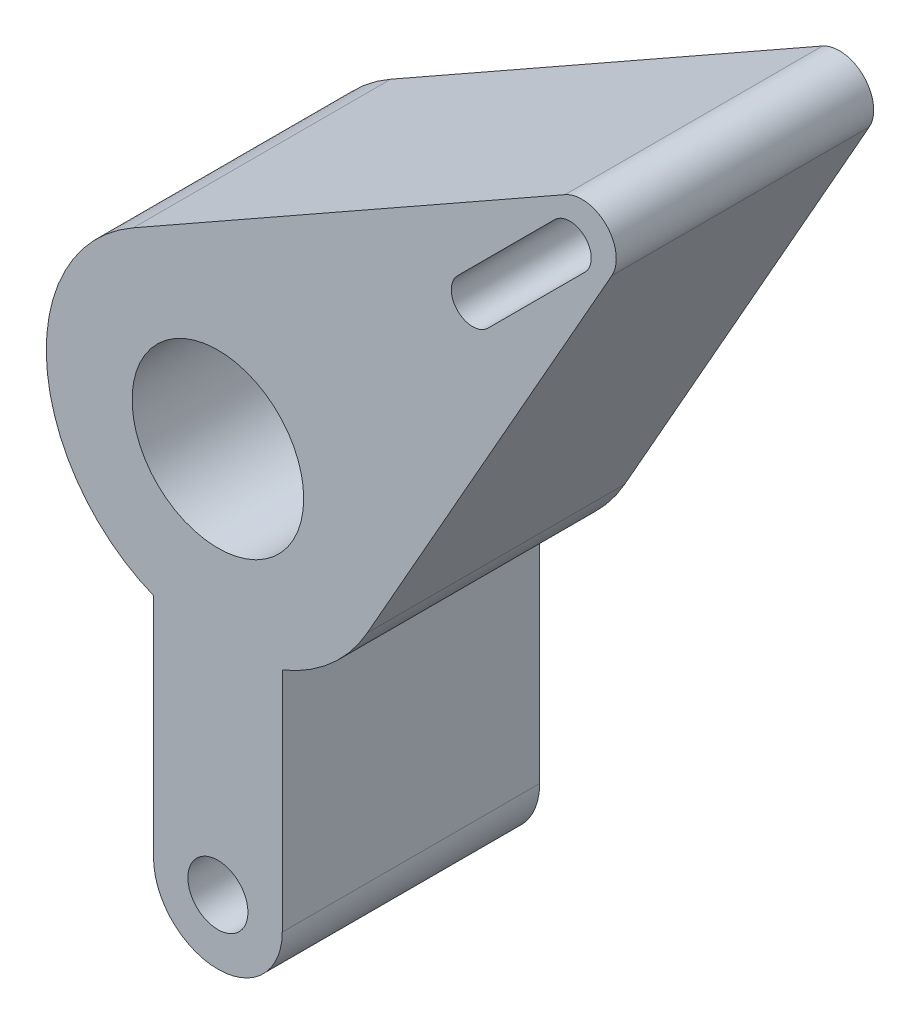
from build123d import *

# Parameters (mm, degrees)
SKETCH_1_R          = 3.5
SKETCH_1_R_2        = 4
EXTRUDE_1_DEPTH     = 30
SKETCH_3_R          = 10
CUT_EXTRUDE_1_DEPTH = 77.234252505


with BuildPart() as part:
    # Эскиз1 → Бобышка-Вытянуть1 (new body)
    # profile 1 of 7: a face of its own
    with BuildSketch(Plane.XY):
        with BuildLine():
            Line((40.454647664, 45.906660544), (-9.858796034, 17.401268367))
            ThreePointArc((-9.858796034, 17.401268367), (10.070354495, 17.279697924), (20, 0))
            ThreePointArc((20, 0), (19.339407531, -5.097775626), (17.401268367, -9.858796034))
            Line((17.401268367, -9.858796034), (45.906660544, 40.454647664))
            ThreePointArc((45.906660544, 40.454647664), (39.597979746, 39.597979746), (40.454647664, 45.906660544))
        make_face()
    # profile 2 of 7: a face of its own
    with BuildSketch(Plane.XY):
        with BuildLine():
            ThreePointArc((20, 0), (10.070354495, 17.279697924), (-9.858796034, 17.401268367))
            ThreePointArc((-9.858796034, 17.401268367), (-19.957067928, -1.309747955), (-7.5, -18.540496218))
            Line((-7.5, -18.540496218), (-7.5, 0))
            ThreePointArc((-7.5, 0), (0, 7.5), (7.5, 0))
            Line((7.5, 0), (7.5, -18.540496218))
            ThreePointArc((7.5, -18.540496218), (13.185646404, -15.037909726), (17.401268367, -9.858796034))
            ThreePointArc((17.401268367, -9.858796034), (19.339407531, -5.097775626), (20, 0))
        make_face()
    # profile 3 of 7: a face of its own
    with BuildSketch(Plane.XY):
        with BuildLine():
            Line((-7.5, 0), (-7.5, -18.540496218))
            ThreePointArc((-7.5, -18.540496218), (0, -20), (7.5, -18.540496218))
            Line((7.5, -18.540496218), (7.5, 0))
            ThreePointArc((7.5, 0), (0, 7.5), (-7.5, 0))
        make_face()
    # profile 4 of 7: a face of its own
    with BuildSketch(Plane.XY):
        with BuildLine():
            ThreePointArc((20, 0), (10.070354495, 17.279697924), (-9.858796034, 17.401268367))
            ThreePointArc((-9.858796034, 17.401268367), (-19.957067928, -1.309747955), (-7.5, -18.540496218))
            Line((-7.5, -18.540496218), (-7.5, 0))
            ThreePointArc((-7.5, 0), (0, 7.5), (7.5, 0))
            Line((7.5, 0), (7.5, -18.540496218))
            ThreePointArc((7.5, -18.540496218), (13.185646404, -15.037909726), (17.401268367, -9.858796034))
            ThreePointArc((17.401268367, -9.858796034), (19.339407531, -5.097775626), (20, 0))
        make_face()
    # profile 5 of 7: a face of its own
    with BuildSketch(Plane.XY):
        with BuildLine():
            Line((-7.5, 0), (-7.5, -18.540496218))
            ThreePointArc((-7.5, -18.540496218), (0, -20), (7.5, -18.540496218))
            Line((7.5, -18.540496218), (7.5, 0))
            ThreePointArc((7.5, 0), (0, 7.5), (-7.5, 0))
        make_face()
    # profile 6 of 7: a face of its own
    with BuildSketch(Plane.XY):
        with BuildLine():
            ThreePointArc((7.5, -18.540496218), (0, -20), (-7.5, -18.540496218))
            Line((-7.5, -18.540496218), (-7.5, -45))
            ThreePointArc((-7.5, -45), (0, -52.5), (7.5, -45))
            Line((7.5, -45), (7.5, -18.540496218))
        make_face()
        with Locations((0, -45)):
            Circle(SKETCH_1_R, mode=Mode.SUBTRACT)
    # profile 7 of 7: a face of its own
    with BuildSketch(Plane.XY):
        with Locations((42.426406871, 42.426406871)):
            Circle(SKETCH_1_R_2)
    extrude(amount=EXTRUDE_1_DEPTH)

    # Эскиз3 → Вырез-Вытянуть1 (cut, through all)
    with BuildSketch(Plane.XY.offset(30)):
        Circle(SKETCH_3_R)
        with BuildLine():
            Line((27.930717857, 31.466251763), (39.244426356, 42.779960262))
            ThreePointArc((39.244426356, 42.779960262), (42.779960262, 42.779960262), (42.779960262, 39.244426356))
            Line((42.779960262, 39.244426356), (31.466251763, 27.930717857))
            ThreePointArc((31.466251763, 27.930717857), (27.930717857, 27.930717857), (27.930717857, 31.466251763))
        make_face()
    extrude(amount=-CUT_EXTRUDE_1_DEPTH, mode=Mode.SUBTRACT)


solid = part.part
